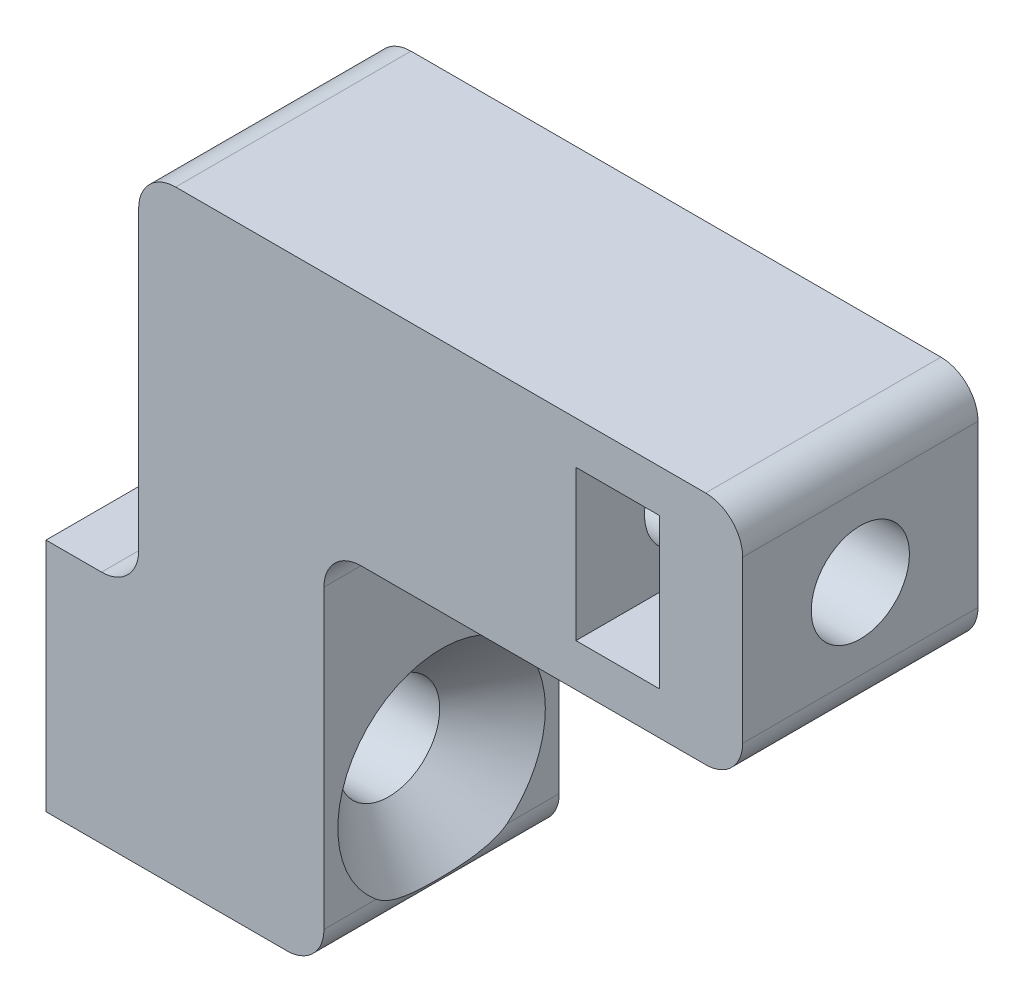
from build123d import *

# Parameters (mm, degrees)
BOSS_EXTRUDE2_DEPTH           = 12.7
FILLET1_R                     = 2
CSK_FOR_M5_SFHCS1_D           = 5.5
CSK_FOR_M5_SFHCS1_CSINK_D     = 11.2
CSK_FOR_M5_SFHCS1_CSINK_ANGLE = 90
M5_CLEARANCE_HOLE1_D          = 5.3
CUT_EXTRUDE1_DEPTH            = 4.5


with BuildPart() as part:
    # Sketch1 → Boss-Extrude2 (new body)
    with BuildSketch(Plane.XY):
        Polygon((0, -26.35), (0, -13.65), (5, -13.65), (5, 6.35), (37.6, 6.35), (37.6, -6.35), (15, -6.35), (15, -26.35), align=None)
    extrude(amount=BOSS_EXTRUDE2_DEPTH)

    # Fillet1
    fillet1_edges = [part.edges().sort_by_distance(p)[0] for p in [
        (5, -13.65, 6.35),
        (5, 6.35, 6.35),
        (37.6, 6.35, 6.35),
        (37.6, -6.35, 6.35),
        (15, -6.35, 6.35),
        (15, -26.35, 6.35),
    ]]
    fillet(fillet1_edges, radius=FILLET1_R)

    # CSK for M5 SFHCS1 (through all)
    with Locations(Plane(origin=(15, 0, 0), x_dir=(0, 0, -1), z_dir=(1, 0, 0))):
        with Locations((-6.35, -20)):
            CounterSinkHole(CSK_FOR_M5_SFHCS1_D / 2, CSK_FOR_M5_SFHCS1_CSINK_D / 2, counter_sink_angle=CSK_FOR_M5_SFHCS1_CSINK_ANGLE)

    # M5 Clearance Hole1 (through all)
    with Locations(Plane(origin=(37.6, 0, 0), x_dir=(0, 0, -1), z_dir=(1, 0, 0))):
        with Locations((-6.35, 0)):
            Hole(M5_CLEARANCE_HOLE1_D / 2)

    # Sketch8 → Cut-Extrude1 (cut)
    with BuildSketch(Plane(origin=(28.6, 0, 0), x_dir=(0, 0, -1), z_dir=(1, 0, 0))):
        Polygon((-12.7, 4.05), (-6.35, 4.05), (-4.01173141, 4.05), (-1.67346282, 0), (-4.01173141, -4.05), (-6.35, -4.05), (-12.7, -4.05), align=None)
    extrude(amount=CUT_EXTRUDE1_DEPTH, mode=Mode.SUBTRACT)


solid = part.part
